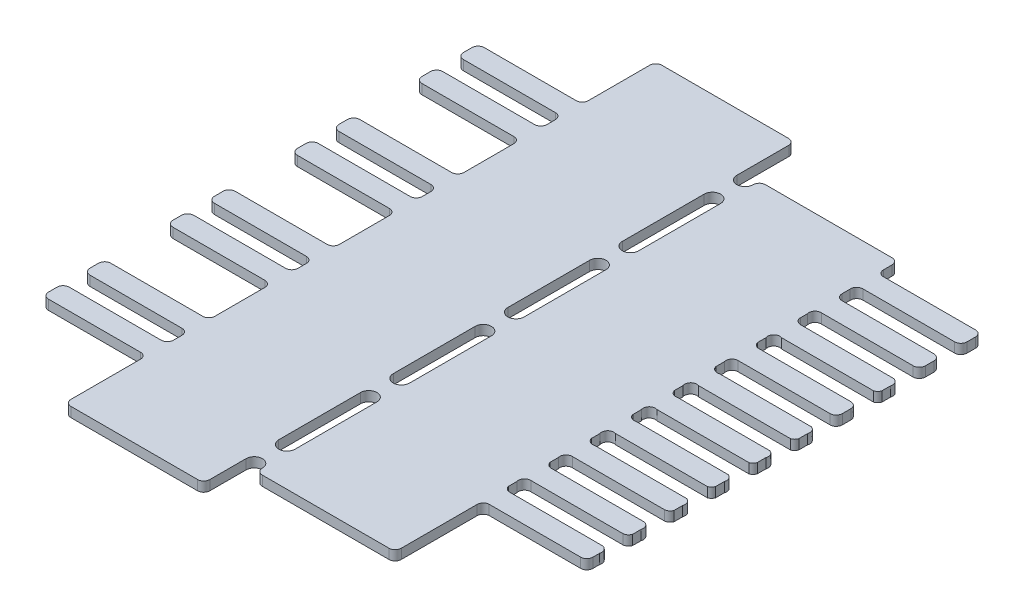
from build123d import *

# Parameters (mm, degrees)
BOSS_EXTRUDE1_DEPTH = 1.2
CUT_EXTRUDE1_DEPTH  = 88.252337996


with BuildPart() as part:
    # Sketch1 → Boss-Extrude1 (new body)
    with BuildSketch(Plane(origin=(0, 0, 0), x_dir=(1, 0, 0), z_dir=(0, 1, 0))):
        with BuildLine():
            Line((-0.75, 10), (-12, 10))
            ThreePointArc((-12, 10), (-12.530330086, 10.219669914), (-12.75, 10.75))
            Line((-12.75, 10.75), (-12.75, 11.79))
            ThreePointArc((-12.75, 11.79), (-12.530330086, 12.320330086), (-12, 12.54))
            Line((-12, 12.54), (-0.75, 12.54))
            ThreePointArc((-0.75, 12.54), (-0.219669914, 12.759669914), (0, 13.29))
            Line((0, 13.29), (0, 14.33))
            ThreePointArc((0, 14.33), (-0.219669914, 14.860330086), (-0.75, 15.08))
            Line((-0.75, 15.08), (-12, 15.08))
            ThreePointArc((-12, 15.08), (-12.530330086, 15.299669914), (-12.75, 15.83))
            Line((-12.75, 15.83), (-12.75, 16.87))
            ThreePointArc((-12.75, 16.87), (-12.530330086, 17.400330086), (-12, 17.62))
            Line((-12, 17.62), (-0.75, 17.62))
            ThreePointArc((-0.75, 17.62), (-0.219669914, 17.839669914), (0, 18.37))
            Line((0, 18.37), (0, 24.49))
            ThreePointArc((0, 24.49), (-0.219669914, 25.020330086), (-0.75, 25.24))
            Line((-0.75, 25.24), (-12, 25.24))
            ThreePointArc((-12, 25.24), (-12.530330086, 25.459669914), (-12.75, 25.99))
            Line((-12.75, 25.99), (-12.75, 27.03))
            ThreePointArc((-12.75, 27.03), (-12.530330086, 27.560330086), (-12, 27.78))
            Line((-12, 27.78), (-0.75, 27.78))
            ThreePointArc((-0.75, 27.78), (-0.219669914, 27.999669914), (0, 28.53))
            Line((0, 28.53), (0, 29.57))
            ThreePointArc((0, 29.57), (-0.219669914, 30.100330086), (-0.75, 30.32))
            Line((-0.75, 30.32), (-12, 30.32))
            ThreePointArc((-12, 30.32), (-12.530330086, 30.539669914), (-12.75, 31.07))
            Line((-12.75, 31.07), (-12.75, 32.11))
            ThreePointArc((-12.75, 32.11), (-12.530330086, 32.640330086), (-12, 32.86))
            Line((-12, 32.86), (-0.75, 32.86))
            ThreePointArc((-0.75, 32.86), (-0.219669914, 33.079669914), (0, 33.61))
            Line((0, 33.61), (0, 39.73))
            ThreePointArc((0, 39.73), (-0.219669914, 40.260330086), (-0.75, 40.48))
            Line((-0.75, 40.48), (-12, 40.48))
            ThreePointArc((-12, 40.48), (-12.530330086, 40.699669914), (-12.75, 41.23))
            Line((-12.75, 41.23), (-12.75, 42.27))
            ThreePointArc((-12.75, 42.27), (-12.530330086, 42.800330086), (-12, 43.02))
            Line((-12, 43.02), (-0.75, 43.02))
            ThreePointArc((-0.75, 43.02), (-0.219669914, 43.239669914), (0, 43.77))
            Line((0, 43.77), (0, 44.81))
            ThreePointArc((0, 44.81), (-0.219669914, 45.340330086), (-0.75, 45.56))
            Line((-0.75, 45.56), (-12, 45.56))
            ThreePointArc((-12, 45.56), (-12.530330086, 45.779669914), (-12.75, 46.31))
            Line((-12.75, 46.31), (-12.75, 47.35))
            ThreePointArc((-12.75, 47.35), (-12.530330086, 47.880330086), (-12, 48.1))
            Line((-12, 48.1), (-0.75, 48.1))
            ThreePointArc((-0.75, 48.1), (-0.219669914, 48.319669914), (0, 48.85))
            Line((0, 48.85), (0, 54.97))
            ThreePointArc((0, 54.97), (-0.219669914, 55.500330086), (-0.75, 55.72))
            Line((-0.75, 55.72), (-12, 55.72))
            ThreePointArc((-12, 55.72), (-12.530330086, 55.939669914), (-12.75, 56.47))
            Line((-12.75, 56.47), (-12.75, 57.51))
            ThreePointArc((-12.75, 57.51), (-12.530330086, 58.040330086), (-12, 58.26))
            Line((-12, 58.26), (-0.75, 58.26))
            ThreePointArc((-0.75, 58.26), (-0.219669914, 58.479669914), (0, 59.01))
            Line((0, 59.01), (0, 60.05))
            ThreePointArc((0, 60.05), (-0.219669914, 60.580330086), (-0.75, 60.8))
            Line((-0.75, 60.8), (-12, 60.8))
            ThreePointArc((-12, 60.8), (-12.530330086, 61.019669914), (-12.75, 61.55))
            Line((-12.75, 61.55), (-12.75, 62.59))
            ThreePointArc((-12.75, 62.59), (-12.530330086, 63.120330086), (-12, 63.34))
            Line((-12, 63.34), (-0.75, 63.34))
            ThreePointArc((-0.75, 63.34), (-0.219669914, 63.559669914), (0, 64.09))
            Line((0, 64.09), (0, 71.59))
            ThreePointArc((0, 71.59), (0.219669914, 72.120330086), (0.75, 72.34))
            Line((0.75, 72.34), (16.25085423, 72.34))
            ThreePointArc((16.25085423, 72.34), (16.76837753, 72.132834813), (17, 71.625785691))
            Line((17, 71.625785691), (17, 65.267878347))
            ThreePointArc((17, 65.267878347), (18, 64.267878347), (19, 65.267878347))
            ThreePointArc((19, 65.267878347), (19.219671741, 65.798205092), (19.75, 66.017873179))
            Line((19.75, 66.017873179), (35.25, 66.017873179))
            ThreePointArc((35.25, 66.017873179), (35.780330086, 65.798203265), (36, 65.267873179))
            Line((36, 65.267873179), (36, 64.228130173))
            ThreePointArc((36, 64.228130173), (36.219669914, 63.697800087), (36.75, 63.478130173))
            Line((36.75, 63.478130173), (48.000824033, 63.478130173))
            ThreePointArc((48.000824033, 63.478130173), (48.531574634, 63.25803941), (48.750823089, 62.726940304))
            Line((48.750823089, 62.726940304), (48.749176911, 61.689320041))
            ThreePointArc((48.749176911, 61.689320041), (48.529087092, 61.159759308), (47.999177855, 60.940509909))
            Line((47.999177855, 60.940509909), (36.748353822, 60.940509909))
            ThreePointArc((36.748353822, 60.940509909), (36.200746149, 60.702980236), (36, 60.140845472))
            Line((36, 60.140845472), (36, 59.148130173))
            ThreePointArc((36, 59.148130173), (36.219669914, 58.617800087), (36.75, 58.398130173))
            Line((36.75, 58.398130173), (48.000824033, 58.398130173))
            ThreePointArc((48.000824033, 58.398130173), (48.531787721, 58.169824368), (48.742739572, 57.631730235))
            Line((48.742739572, 57.631730235), (48.741117526, 56.609320041))
            ThreePointArc((48.741117526, 56.609320041), (48.521027706, 56.079759308), (47.991118469, 55.860509909))
            Line((47.991118469, 55.860509909), (36.740294437, 55.860509909))
            ThreePointArc((36.740294437, 55.860509909), (36.124613834, 55.568017148), (36, 54.897878347))
            Line((36, 54.897878347), (36, 54.068130173))
            ThreePointArc((36, 54.068130173), (36.219669914, 53.537800087), (36.75, 53.318130173))
            Line((36.75, 53.318130173), (48.000824033, 53.318130173))
            ThreePointArc((48.000824033, 53.318130173), (48.61904302, 53.018842914), (48.734347034, 52.341736892))
            Line((48.734347034, 52.341736892), (48.732697083, 51.301738201))
            ThreePointArc((48.732697083, 51.301738201), (48.545704688, 50.975154445), (48.223623005, 50.780509909))
            Line((48.223623005, 50.780509909), (36.972798972, 50.780509909))
            ThreePointArc((36.972798972, 50.780509909), (36.174802971, 50.614081756), (36, 49.817878347))
            Line((36, 49.817878347), (36, 48.777878347))
            ThreePointArc((36, 48.777878347), (36.272387761, 48.386273996), (36.725821843, 48.238130173))
            Line((36.725821843, 48.238130173), (47.976645876, 48.238130173))
            ThreePointArc((47.976645876, 48.238130173), (48.507396477, 48.01803941), (48.726644932, 47.486940304))
            Line((48.726644932, 47.486940304), (48.724998754, 46.449320041))
            ThreePointArc((48.724998754, 46.449320041), (48.504908935, 45.919759308), (47.974999698, 45.700509909))
            Line((47.974999698, 45.700509909), (36.724175666, 45.700509909))
            ThreePointArc((36.724175666, 45.700509909), (36.119881112, 45.40140321), (36, 44.737878347))
            Line((36, 44.737878347), (36, 43.697878347))
            ThreePointArc((36, 43.697878347), (36.362194968, 43.21781462), (36.96059629, 43.158130173))
            Line((36.96059629, 43.158130173), (48.211420322, 43.158130173))
            ThreePointArc((48.211420322, 43.158130173), (48.677962236, 42.780573026), (48.718228283, 42.181749678))
            Line((48.718228283, 42.181749678), (48.716578332, 41.141750987))
            ThreePointArc((48.716578332, 41.141750987), (48.529594415, 40.815162665), (48.207517991, 40.620509909))
            Line((48.207517991, 40.620509909), (36.956693958, 40.620509909))
            ThreePointArc((36.956693958, 40.620509909), (36.172929573, 40.44272769), (36, 39.657878347))
            Line((36, 39.657878347), (36, 38.617878347))
            ThreePointArc((36, 38.617878347), (36.359268306, 38.141524705), (36.952536914, 38.078130173))
            Line((36.952536914, 38.078130173), (48.203360947, 38.078130173))
            ThreePointArc((48.203360947, 38.078130173), (48.669899848, 37.700575383), (48.710168907, 37.101756071))
            Line((48.710168907, 37.101756071), (48.708518957, 36.06175738))
            ThreePointArc((48.708518957, 36.06175738), (48.521536353, 35.735165387), (48.199458615, 35.540509909))
            Line((48.199458615, 35.540509909), (36.948634583, 35.540509909))
            ThreePointArc((36.948634583, 35.540509909), (36.17185962, 35.357253965), (36, 34.577878347))
            Line((36, 34.577878347), (36, 33.537878347))
            ThreePointArc((36, 33.537878347), (36.356328135, 33.065178209), (36.944477539, 32.998130173))
            Line((36.944477539, 32.998130173), (48.195301571, 32.998130173))
            ThreePointArc((48.195301571, 32.998130173), (48.66183746, 32.62057774), (48.702109532, 32.021762465))
            Line((48.702109532, 32.021762465), (48.700459581, 30.981763773))
            ThreePointArc((48.700459581, 30.981763773), (48.513478291, 30.65516811), (48.19139924, 30.460509909))
            Line((48.19139924, 30.460509909), (36.940575207, 30.460509909))
            ThreePointArc((36.940575207, 30.460509909), (36.170708413, 30.271909192), (36, 29.497878347))
            Line((36, 29.497878347), (36, 28.457878347))
            ThreePointArc((36, 28.457878347), (36.353374809, 27.988776352), (36.936418163, 27.918130173))
            Line((36.936418163, 27.918130173), (48.187242196, 27.918130173))
            ThreePointArc((48.187242196, 27.918130173), (48.653775072, 27.540580098), (48.694050156, 26.941768858))
            Line((48.694050156, 26.941768858), (48.692400206, 25.901770166))
            ThreePointArc((48.692400206, 25.901770166), (48.429121329, 25.53100797), (48.000016788, 25.380509909))
            Line((48.000016788, 25.380509909), (36.750016788, 25.380509909))
            ThreePointArc((36.750016788, 25.380509909), (36.127411934, 25.092104385), (36, 24.417878347))
            Line((36, 24.417878347), (36, 23.377878347))
            ThreePointArc((36, 23.377878347), (36.282013095, 22.978780968), (36.750016788, 22.838130173))
            Line((36.750016788, 22.838130173), (48.000016788, 22.838130173))
            ThreePointArc((48.000016788, 22.838130173), (48.584817435, 22.519847769), (48.685990781, 21.861775251))
            Line((48.685990781, 21.861775251), (48.68434083, 20.82177656))
            ThreePointArc((48.68434083, 20.82177656), (48.424342017, 20.453278559), (48.000016788, 20.300509909))
            Line((48.000016788, 20.300509909), (36.750016788, 20.300509909))
            ThreePointArc((36.750016788, 20.300509909), (36.127411934, 20.012104385), (36, 19.337878347))
            Line((36, 19.337878347), (36, 18.297878347))
            ThreePointArc((36, 18.297878347), (36.282013095, 17.898780968), (36.750016788, 17.758130173))
            Line((36.750016788, 17.758130173), (48.000016788, 17.758130173))
            ThreePointArc((48.000016788, 17.758130173), (48.579248089, 17.436786959), (48.677931406, 16.781781644))
            Line((48.677931406, 16.781781644), (48.676642441, 15.969320041))
            ThreePointArc((48.676642441, 15.969320041), (48.456552621, 15.439759308), (47.926643385, 15.220509909))
            Line((47.926643385, 15.220509909), (36.675819352, 15.220509909))
            ThreePointArc((36.675819352, 15.220509909), (36.194061386, 14.977607995), (36, 14.474187438))
            Line((36, 14.474187438), (36, 5.183006715))
            ThreePointArc((36, 5.183006715), (35.780330086, 4.652676629), (35.25, 4.433006715))
            Line((35.25, 4.433006715), (19.75, 4.433006715))
            ThreePointArc((19.75, 4.433006715), (19.219669914, 4.652676629), (19, 5.183006715))
            ThreePointArc((19, 5.183006715), (18, 6.183006715), (17, 5.183006715))
            Line((17, 5.183006715), (17, 0.75))
            ThreePointArc((17, 0.75), (16.780330086, 0.219669914), (16.25, 0))
            Line((16.25, 0), (0.75, 0))
            ThreePointArc((0.75, 0), (0.219669914, 0.219669914), (0, 0.75))
            Line((0, 0.75), (0, 9.25))
            ThreePointArc((0, 9.25), (-0.219669914, 9.780330086), (-0.75, 10))
        make_face()
    extrude(amount=BOSS_EXTRUDE1_DEPTH)

    # Sketch2 → Cut-Extrude1 (cut, through all)
    with BuildSketch(Plane.XZ):
        with BuildLine():
            Line((17, -61.267878347), (17, -51.247878347))
            ThreePointArc((17, -51.247878347), (18, -50.247878347), (19, -51.247878347))
            Line((19, -51.247878347), (19, -61.267878347))
            ThreePointArc((19, -61.267878347), (18, -62.267878347), (17, -61.267878347))
        make_face()
        with BuildLine():
            Line((17, -47.247878347), (17, -37.227878347))
            ThreePointArc((17, -37.227878347), (18, -36.227878347), (19, -37.227878347))
            Line((19, -37.227878347), (19, -47.247878347))
            ThreePointArc((19, -47.247878347), (18, -48.247878347), (17, -47.247878347))
        make_face()
        with BuildLine():
            Line((17, -23.203006715), (17, -33.223006715))
            ThreePointArc((17, -33.223006715), (18, -34.223006715), (19, -33.223006715))
            Line((19, -33.223006715), (19, -23.203006715))
            ThreePointArc((19, -23.203006715), (18, -22.203006715), (17, -23.203006715))
        make_face()
        with BuildLine():
            Line((17, -9.183006715), (17, -19.203006715))
            ThreePointArc((17, -19.203006715), (18, -20.203006715), (19, -19.203006715))
            Line((19, -19.203006715), (19, -9.183006715))
            ThreePointArc((19, -9.183006715), (18, -8.183006715), (17, -9.183006715))
        make_face()
    extrude(amount=-CUT_EXTRUDE1_DEPTH, mode=Mode.SUBTRACT)


solid = part.part
